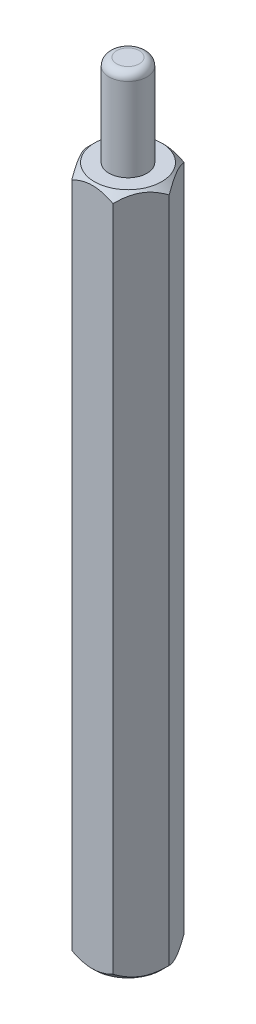
from build123d import *

# Parameters (mm, degrees)
EXTRUDE_1_DEPTH     = 45
SKETCH_2_R          = 1.25
CUT_EXTRUDE_1_DEPTH = 10
SKETCH_4_R          = 1.25
EXTRUDE_2_DEPTH     = 6
FILLET_1_R          = 0.5


with BuildPart() as part:
    # 草图1 → 凸台-拉伸1 (new body)
    with BuildSketch(Plane(origin=(0, 0, 0), x_dir=(1, 0, 0), z_dir=(0, 1, 0))):
        Polygon((2.713546265, 0), (1.356773133, 2.35), (-1.356773133, 2.35), (-2.713546265, 0), (-1.356773133, -2.35), (1.356773133, -2.35), align=None)
    extrude(amount=EXTRUDE_1_DEPTH)

    # 草图2 → 切除-拉伸1 (cut)
    with BuildSketch(Plane.XZ):
        with Locations(Location((0, 0, 0), (0, 0, 270))):
            Circle(SKETCH_2_R)
    extrude(amount=-CUT_EXTRUDE_1_DEPTH, mode=Mode.SUBTRACT)

    # 草图7 → 切除-旋转4 (revolve, cut)
    with BuildSketch(Plane.XY, mode=Mode.PRIVATE) as cut_revolve_4_sk:
        Polygon((-2.713546265, 45), (-2.713546265, 44.5), (-2.213546265, 45), align=None)
    cut_revolve_4 = revolve(cut_revolve_4_sk.sketch.rotate(Axis((0, 0, 0), (0, 1, 0)), 270), axis=Axis((0, 0, 0), (0, 1, 0)), mode=Mode.SUBTRACT)

    # 镜向1: 切除-旋转4 across plane
    add(cut_revolve_4.mirror(Plane(origin=(0, 22.5, 0), x_dir=(0, 0, 1), z_dir=(0, -1, 0))), mode=Mode.SUBTRACT)


with BuildPart() as body_2:
    # 草图4 → 凸台-拉伸2 (new body)
    with BuildSketch(Plane(origin=(0, 45, 0), x_dir=(1, 0, 0), z_dir=(0, 1, 0))):
        with Locations(Location((0, 0, 0), (0, 0, 270))):
            Circle(SKETCH_4_R)
    extrude(amount=EXTRUDE_2_DEPTH)

    # 圆角1
    fillet_1_edges = [body_2.edges().sort_by_distance(p)[0] for p in [
        (0, 51, -1.25),
    ]]
    fillet(fillet_1_edges, radius=FILLET_1_R)


solid = Compound([part.part, body_2.part])
